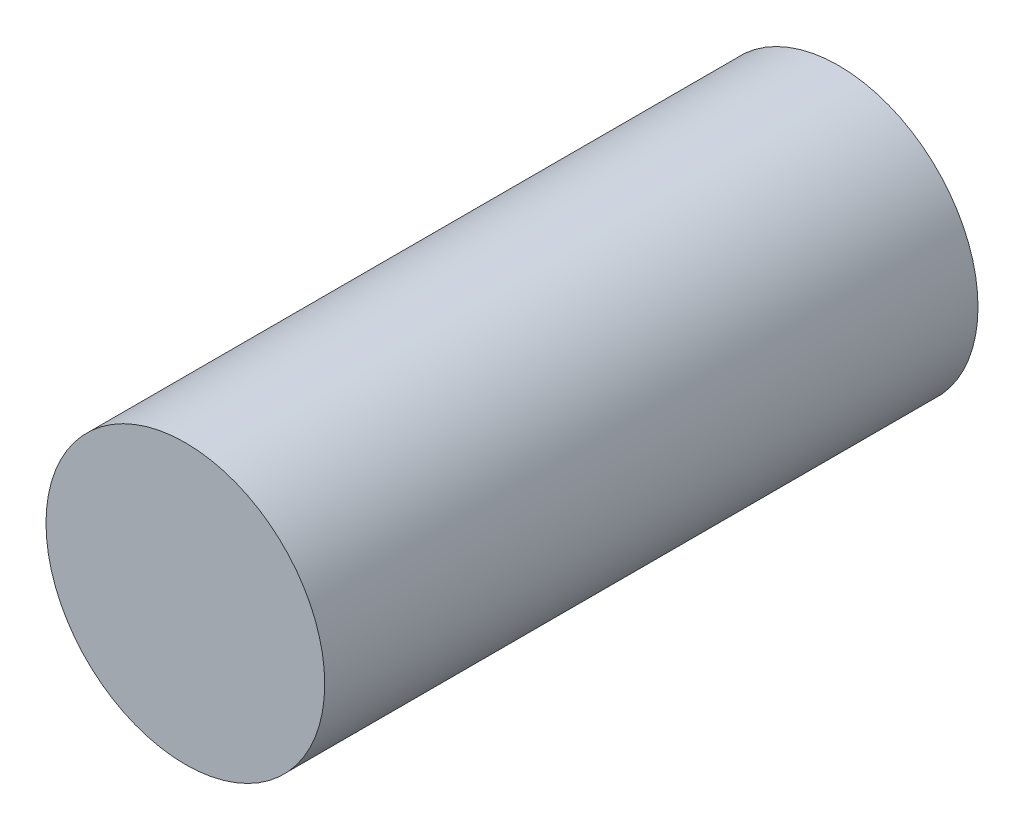
from build123d import *

# Parameters (mm, degrees)
SKETCH2_R           = 64
BOSS_EXTRUDE1_DEPTH = 300
CUT_EXTRUDE1_START  = 10
SKETCH3_R           = 60
CUT_EXTRUDE1_DEPTH  = 280


with BuildPart() as part:
    # Sketch2 → Boss-Extrude1 (new body)
    with BuildSketch(Plane.XY):
        Circle(SKETCH2_R)
    extrude(amount=BOSS_EXTRUDE1_DEPTH)

    # Sketch3 → Cut-Extrude1 (cut)
    with BuildSketch(Plane.XY.offset(CUT_EXTRUDE1_START)):
        Circle(SKETCH3_R)
    extrude(amount=CUT_EXTRUDE1_DEPTH, mode=Mode.SUBTRACT)


solid = part.part
